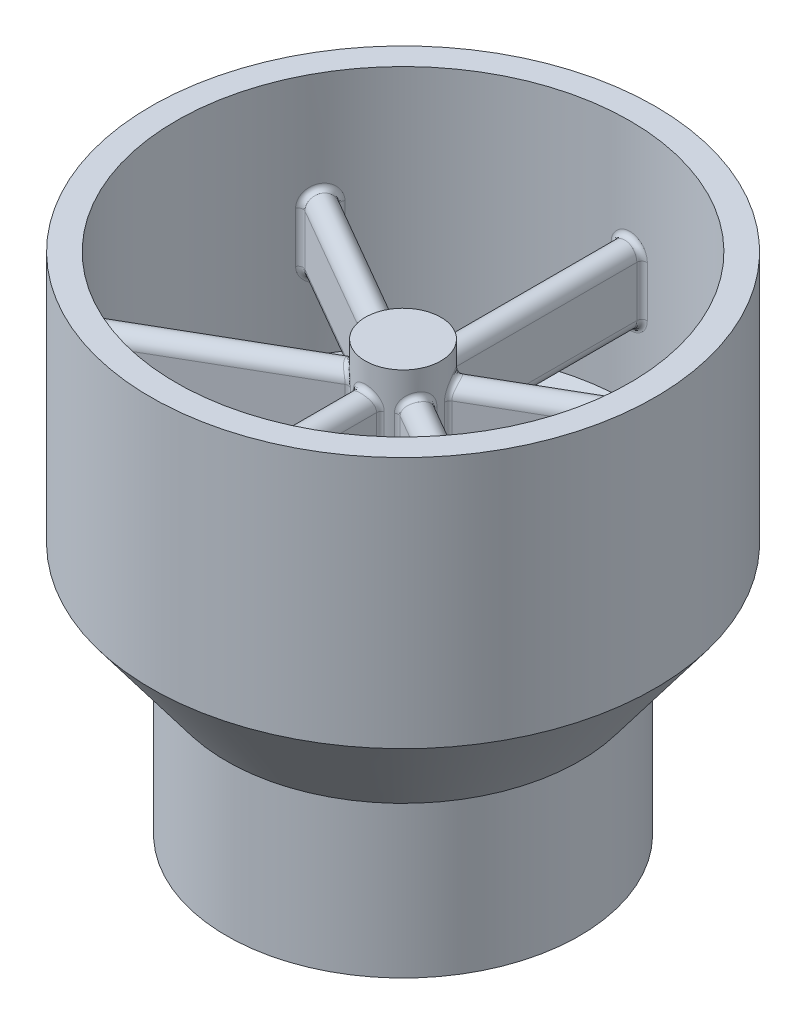
from build123d import *

# Parameters (mm, degrees)
SHELL_3_T                        = -5
SKETCH_2_R                       = 7.5
EXTRUDE_1_DEPTH                  = 25
EXTRUDE_2_REACH                  = 124.474
EXTRUDE_2_END_RADIUS             = 45
FILLET_1_R                       = 1
PATTERN_CIRCULAR_1_COUNT         = 6
FILLET_1_OF_PATTERN_CIRCULAR_1_R = 1


with BuildPart() as part:
    # Эскиз1 → Повернуть1 (revolve)
    with BuildSketch(Plane.XY, mode=Mode.PRIVATE) as revolve_1_sk:
        Polygon((-35, -100), (0, -100), (0, 0), (-50, 0), (-50, -50), (-35, -70), align=None)
    revolve(revolve_1_sk.sketch.rotate(Axis((0, 0, 0), (0, 1, 0)), 270), axis=Axis((0, 0, 0), (0, 1, 0)))

    # Оболочка3
    shell_3_openings = [part.faces().sort_by_distance(p)[0] for p in [
        (0, 0, 0),
        (0, -100, 0),
    ]]
    offset(amount=SHELL_3_T, openings=shell_3_openings, kind=Kind.INTERSECTION)



with BuildPart() as body_2:
    # Эскиз2 → Бобышка-Вытянуть1 (new body)
    with BuildSketch(Plane(origin=(0, -15, 0), x_dir=(1, 0, 0), z_dir=(0, 1, 0))):
        with Locations(Location((0, 0, 0), (0, 0, 270))):
            Circle(SKETCH_2_R)
    extrude(amount=-EXTRUDE_1_DEPTH)


with BuildPart() as part_1:
    add(part.part)

    add(body_2.part)  # Бобышка-Вытянуть2 merges body 2
    # Бобышка-Вытянуть2: up to this cylinder (the profile starts inside it)
    extrude_2_end = Plane(origin=(0, -27.5, 0), z_dir=(0, -1, 0)) * Cylinder(EXTRUDE_2_END_RADIUS, 339.948, mode=Mode.PRIVATE)
    # Эскиз3 → Бобышка-Вытянуть2 (add, up to the surface)
    with BuildSketch(Plane.XY, mode=Mode.PRIVATE) as extrude_2_sk1:
        with BuildLine():
            Line((-2.5, -32.5), (-2.5, -22.5))
            ThreePointArc((-2.5, -22.5), (0, -20), (2.5, -22.5))
            Line((2.5, -22.5), (2.5, -32.5))
            ThreePointArc((2.5, -32.5), (0, -35), (-2.5, -32.5))
        make_face()
    extrude_2_tool1 = extrude(extrude_2_sk1.sketch, amount=-EXTRUDE_2_REACH, mode=Mode.PRIVATE) & extrude_2_end
    extrude_2 = extrude_2_tool1.solids().sort_by_distance((0, -27.5, 0))[0]
    add(extrude_2)

    # Скругление1
    fillet_1_edges = [part_1.edges().sort_by_distance(p)[0] for p in [
        (-1.767767128, -34.267766778, -44.965264365),
        (-2.5, -27.5, -44.930501889),
        (1.767767128, -20.732233222, -44.965264365),
        (2.5, -27.5, -44.930501889),
        (2.5, -27.5, -7.071067812),
        (-2.5, -27.5, -7.071067812),
        (2.5, -27.5, -7.071067812),
        (0, -20, -7.5),
    ]]
    fillet(fillet_1_edges, radius=FILLET_1_R)

    # Круговой массив1: Бобышка-Вытянуть2 ×6 about axis
    pattern_circular_1_axis = Axis((0, 0, 0), (0, -1, 0))
    for i in range(1, PATTERN_CIRCULAR_1_COUNT):
        add(extrude_2.rotate(pattern_circular_1_axis, i * 360 / PATTERN_CIRCULAR_1_COUNT))

    # Скругление1 of Круговой массив1
    fillet_1_of_pattern_circular_1_edges = [part_1.edges().sort_by_distance(p)[0] for p in [
        (38.057177664, -34.267766778, -24.013563423),
        (37.660956041, -27.5, -24.630314454),
        (39.824944792, -20.732233222, -20.951700941),
        (40.160956041, -27.5, -20.300187435),
        (7.373724357, -27.5, -1.370470396),
        (4.873724357, -27.5, -5.700597415),
        (7.373724357, -27.5, -1.370470396),
        (6.495190528, -20, -3.75),
        (39.824944792, -34.267766778, 20.951700941),
        (40.160956041, -27.5, 20.300187435),
        (38.057177664, -20.732233222, 24.013563423),
        (37.660956041, -27.5, 24.630314454),
        (4.873724357, -27.5, 5.700597415),
        (7.373724357, -27.5, 1.370470396),
        (4.873724357, -27.5, 5.700597415),
        (6.495190528, -20, 3.75),
        (1.767767128, -34.267766778, 44.965264365),
        (2.5, -27.5, 44.930501889),
        (-1.767767128, -20.732233222, 44.965264365),
        (-2.5, -27.5, 44.930501889),
        (-2.5, -27.5, 7.071067812),
        (2.5, -27.5, 7.071067812),
        (-2.5, -27.5, 7.071067812),
        (0, -20, 7.5),
        (-38.057177664, -34.267766778, 24.013563423),
        (-37.660956041, -27.5, 24.630314454),
        (-39.824944792, -20.732233222, 20.951700941),
        (-40.160956041, -27.5, 20.300187435),
        (-7.373724357, -27.5, 1.370470396),
        (-4.873724357, -27.5, 5.700597415),
        (-7.373724357, -27.5, 1.370470396),
        (-6.495190528, -20, 3.75),
        (-39.824944792, -34.267766778, -20.951700941),
        (-40.160956041, -27.5, -20.300187435),
        (-38.057177664, -20.732233222, -24.013563423),
        (-37.660956041, -27.5, -24.630314454),
        (-4.873724357, -27.5, -5.700597415),
        (-7.373724357, -27.5, -1.370470396),
        (-4.873724357, -27.5, -5.700597415),
        (-6.495190528, -20, -3.75),
    ]]
    fillet(fillet_1_of_pattern_circular_1_edges, radius=FILLET_1_OF_PATTERN_CIRCULAR_1_R)


solid = part_1.part
